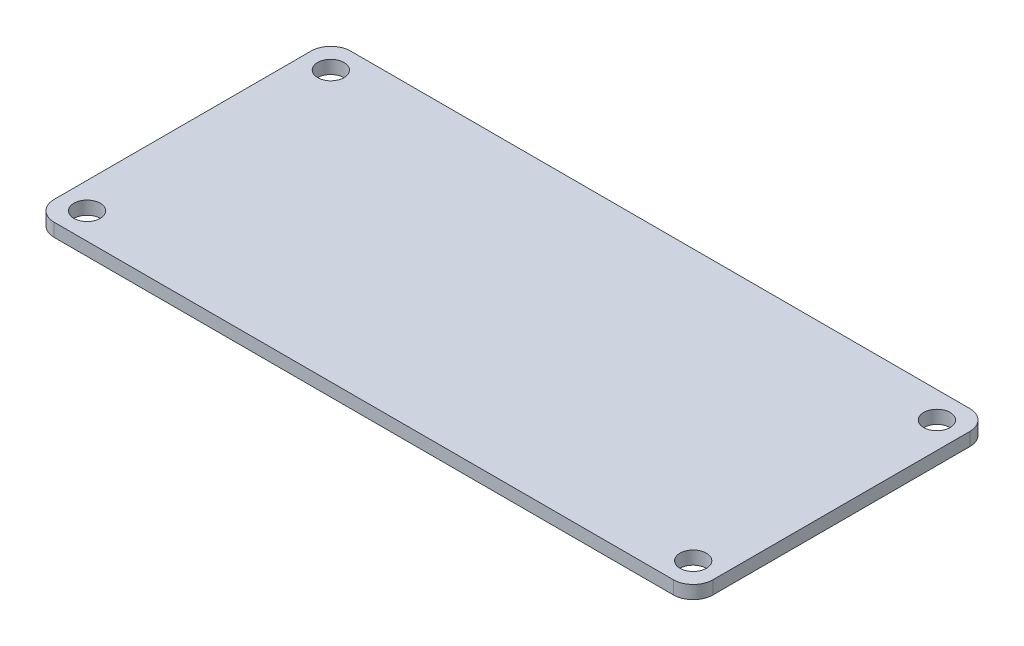
from build123d import *

# Parameters (mm, degrees)
ESBO_O1_W                = 100
ESBO_O1_H                = 45
RESSALTO_EXTRUS_O1_DEPTH = 2
ESBO_O5_R                = 2
CORTE_EXTRUS_O3_DEPTH    = 55.865745233
FILETE1_R                = 3


with BuildPart() as part:
    # Esboço1 → Ressalto-extrusão1 (new body)
    with BuildSketch(Plane(origin=(0, 0, 0), x_dir=(1, 0, 0), z_dir=(0, 1, 0))):
        Rectangle(ESBO_O1_W, ESBO_O1_H)
    extrude(amount=RESSALTO_EXTRUS_O1_DEPTH)

    # Esboço5 → Corte-extrusão3 (cut, through all)
    with BuildSketch(Plane(origin=(0, 2, 0), x_dir=(1, 0, 0), z_dir=(0, 1, 0))):
        with Locations(Location((46, 18.5, 0), (0, 0, 270))):
            Circle(ESBO_O5_R)
        with Locations(Location((46, -18.5, 0), (0, 0, 90))):
            Circle(ESBO_O5_R)
        with Locations(Location((-46, -18.5, 0), (0, 0, 270))):
            Circle(ESBO_O5_R)
        with Locations(Location((-46, 18.5, 0), (0, 0, 90))):
            Circle(ESBO_O5_R)
    extrude(amount=-CORTE_EXTRUS_O3_DEPTH, mode=Mode.SUBTRACT)

    # Filete1
    filete1_edges = [part.edges().sort_by_distance(p)[0] for p in [
        (-50, 1, -22.5),
        (50, 1, -22.5),
        (50, 1, 22.5),
        (-50, 1, 22.5),
    ]]
    fillet(filete1_edges, radius=FILETE1_R)


solid = part.part
